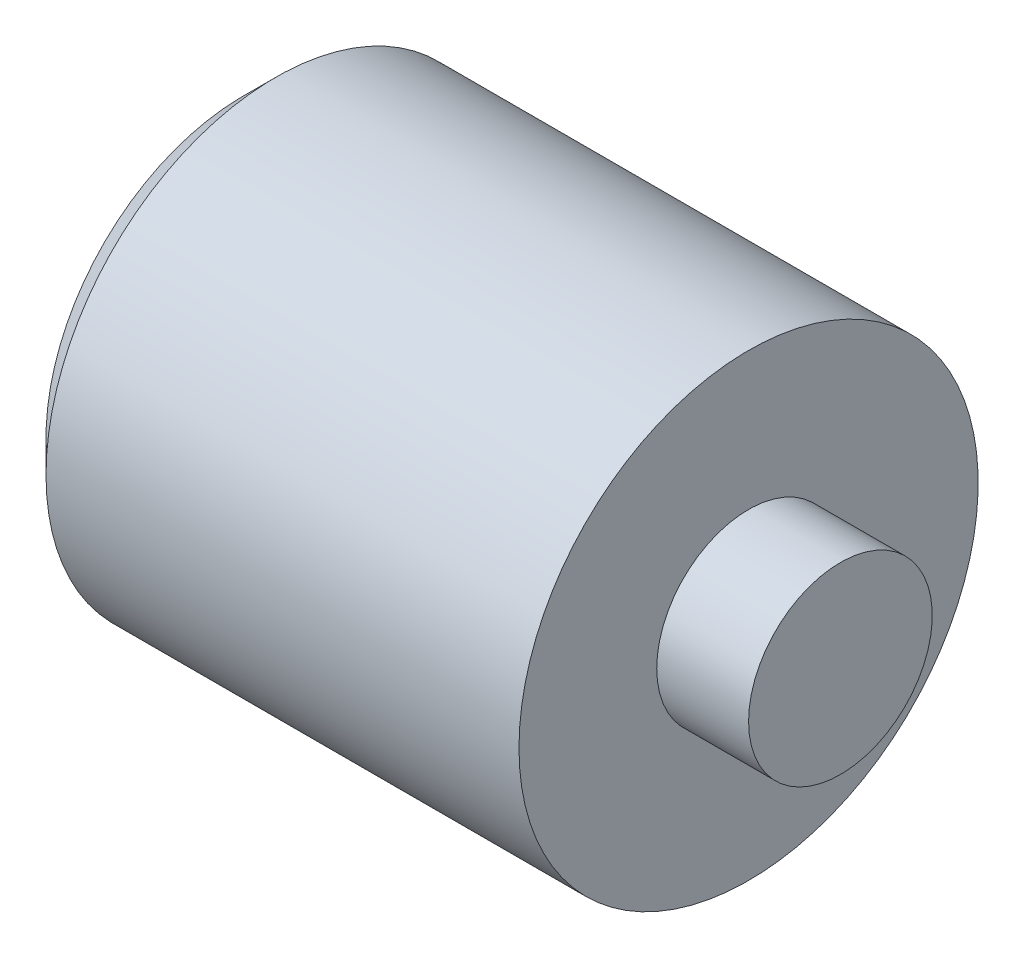
from build123d import *

# Parameters (mm, degrees)
CHANFREIN1_SIZE = 0.7


with BuildPart() as part:
    # Esquisse1 → Base-Révolution (revolve)
    with BuildSketch(Plane.XY, mode=Mode.PRIVATE) as base_r_volution_sk:
        Polygon((0, 5), (0, 0), (13, 0), (13, 2), (11, 2), (11, 5), align=None)
    revolve(base_r_volution_sk.sketch.rotate(Axis((0, 0, 0), (1, 0, 0)), 90), axis=Axis((0, 0, 0), (1, 0, 0)))

    # Chanfrein1
    chanfrein1_edges = [part.edges().sort_by_distance(p)[0] for p in [
        (0, 0, -5),
    ]]
    chamfer(chanfrein1_edges, length=CHANFREIN1_SIZE)


solid = part.part
